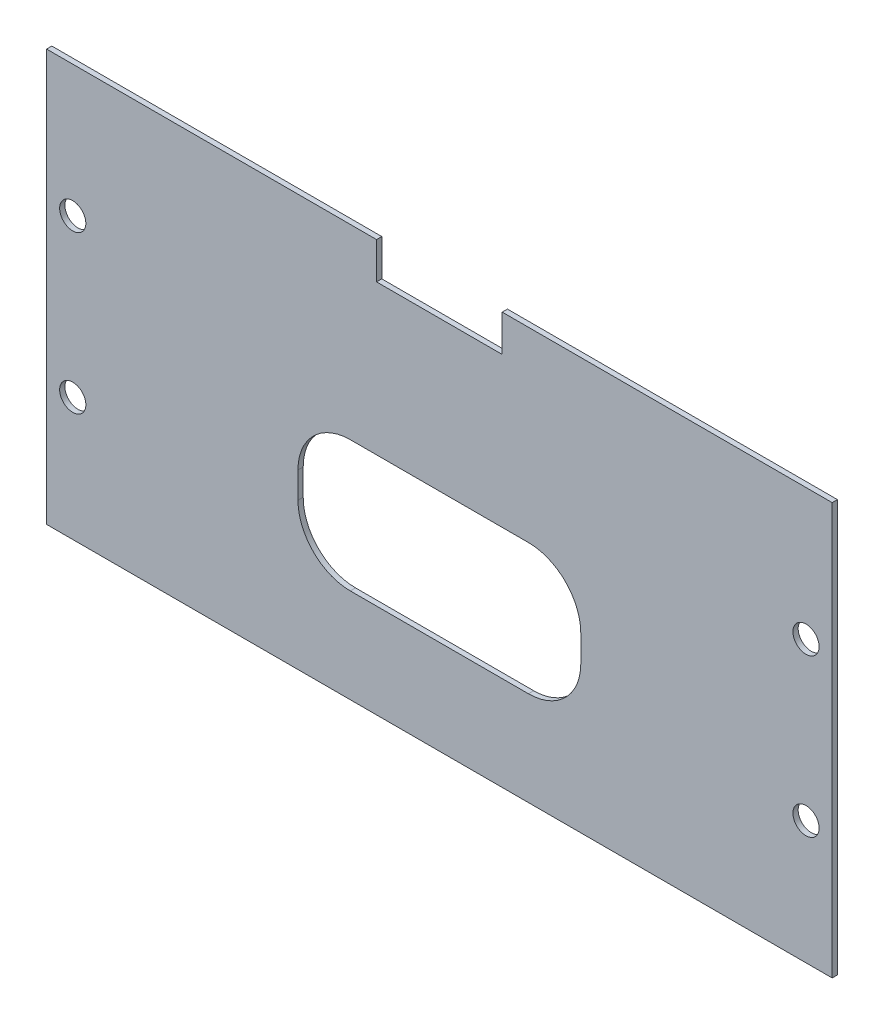
from build123d import *

# Parameters (mm, degrees)
SKETCH1_W           = 150
SKETCH1_H           = 83.6
BOSS_EXTRUDE1_DEPTH = 1
SKETCH2_W           = 54
SKETCH2_H           = 25
CUT_EXTRUDE1_DEPTH  = 86.867572459
SKETCH3_R           = 2.5
CUT_EXTRUDE2_DEPTH  = 6.5
CUT_EXTRUDE3_DEPTH  = 10
FILLET1_R           = 10
SKETCH5_W           = 150
SKETCH5_H           = 5
CUT_EXTRUDE4_DEPTH  = 10


with BuildPart() as part:
    # Sketch1 → Boss-Extrude1 (new body)
    with BuildSketch(Plane.XY):
        Rectangle(SKETCH1_W, SKETCH1_H)
    extrude(amount=BOSS_EXTRUDE1_DEPTH)

    # Sketch2 → Cut-Extrude1 (cut, through all)
    with BuildSketch(Plane.XY.offset(1)):
        with Locations((0, -6.3)):
            Rectangle(SKETCH2_W, SKETCH2_H)
    extrude(amount=-CUT_EXTRUDE1_DEPTH, mode=Mode.SUBTRACT)

    # Sketch3 → Cut-Extrude2 (cut)
    with BuildSketch(Plane.XY.offset(1)):
        with Locations((-70, 16.72)):
            Circle(SKETCH3_R)
        with Locations((-70, -13.28)):
            Circle(SKETCH3_R)
        with Locations((70, 16.72)):
            Circle(SKETCH3_R)
        with Locations((70, -13.28)):
            Circle(SKETCH3_R)
    extrude(amount=-CUT_EXTRUDE2_DEPTH, mode=Mode.SUBTRACT)

    # Sketch4 → Cut-Extrude3 (cut)
    with BuildSketch(Plane.XY.offset(1)):
        Polygon((0, 34.8), (12, 34.8), (12, 41.8), (-12, 41.8), (-12, 34.8), align=None)
    extrude(amount=-CUT_EXTRUDE3_DEPTH, mode=Mode.SUBTRACT)

    # Fillet1
    fillet1_edges = [part.edges().sort_by_distance(p)[0] for p in [
        (27, -18.8, 0.5),
        (-27, -18.8, 0.5),
        (-27, 6.2, 0.5),
        (27, 6.2, 0.5),
    ]]
    fillet(fillet1_edges, radius=FILLET1_R)

    # Sketch5 → Cut-Extrude4 (cut)
    with BuildSketch(Plane.XY.offset(1)):
        with Locations((0, -39.3)):
            Rectangle(SKETCH5_W, SKETCH5_H)
    extrude(amount=-CUT_EXTRUDE4_DEPTH, mode=Mode.SUBTRACT)


solid = part.part
